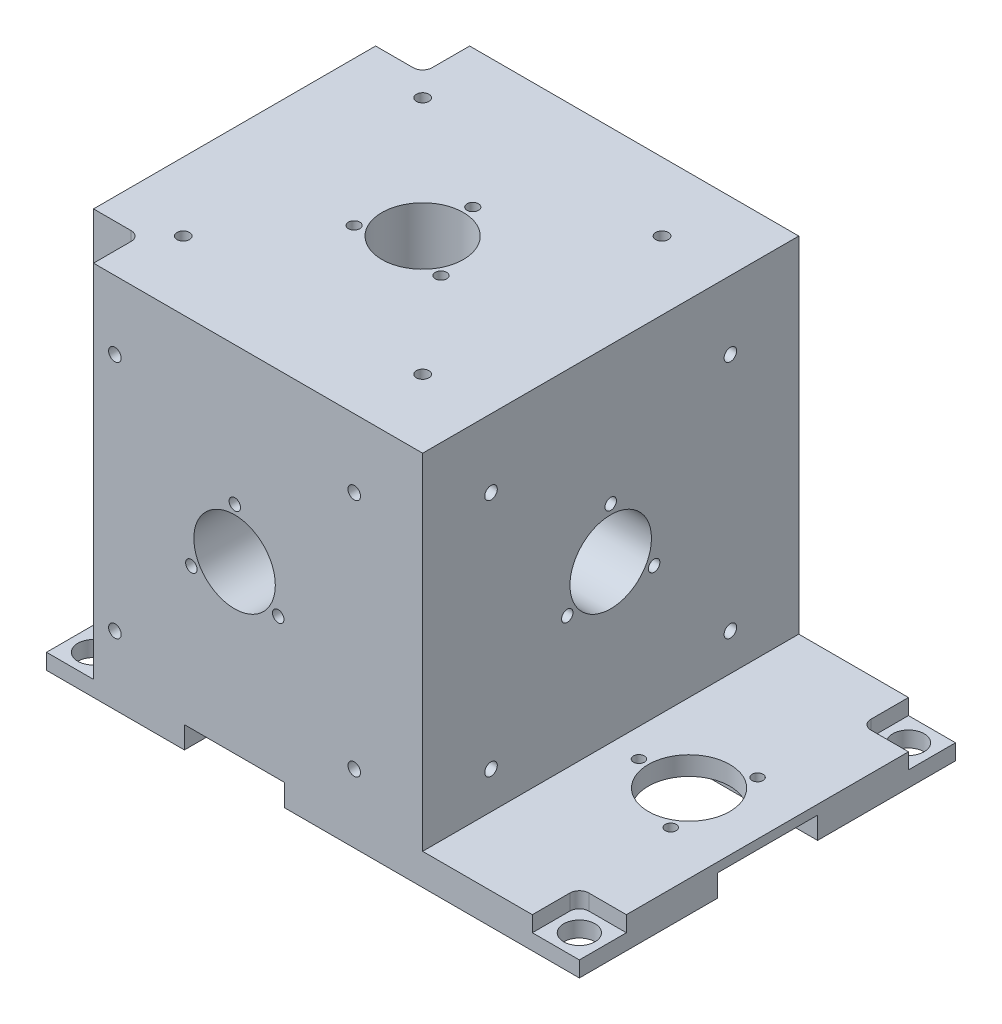
from build123d import *

# Parameters (mm, degrees)
BOSS_EXTRUDE1_DEPTH = 120
SKETCH3_W           = 120
SKETCH3_H           = 10
BOSS_EXTRUDE2_DEPTH = 50
SKETCH11_R          = 13
CUT_EXTRUDE3_DEPTH  = 120
SKETCH7_R           = 1.825
SKETCH7_R_2         = 2
CUT_EXTRUDE6_DEPTH  = 5
CUT_EXTRUDE12_DEPTH = 4
SKETCH10_R          = 13
CUT_EXTRUDE13_DEPTH = 116
SKETCH8_R           = 1.825
SKETCH8_R_2         = 2
CUT_EXTRUDE14_DEPTH = 5
SKETCH13_R          = 13
CUT_EXTRUDE17_DEPTH = 120
SKETCH17_R          = 13
CUT_EXTRUDE18_DEPTH = 6
SKETCH18_R          = 1.75
CUT_EXTRUDE19_DEPTH = 6
FILLET1_R           = 3
FILLET2_R           = 3
CHAMFER1_SIZE       = 3
SKETCH19_W          = 15
SKETCH19_H          = 15
CUT_EXTRUDE20_DEPTH = 115
SKETCH20_R          = 5
CUT_EXTRUDE21_DEPTH = 5
FILLET3_R           = 3
SKETCH21_W          = 15
SKETCH21_H          = 15
CUT_EXTRUDE22_DEPTH = 5
SKETCH22_R          = 5
CUT_EXTRUDE23_DEPTH = 5
FILLET4_R           = 3
CUT_EXTRUDE24_START = -5
SKETCH23_R          = 1.825
SKETCH23_R_2        = 2
CUT_EXTRUDE24_DEPTH = 5
CUT_EXTRUDE25_START = -5
SKETCH24_R          = 1.825
SKETCH24_R_2        = 2
CUT_EXTRUDE25_DEPTH = 5
SKETCH26_R          = 1.825
SKETCH26_R_2        = 2
CUT_EXTRUDE26_DEPTH = 5


with BuildPart() as part:
    # Sketch1 → Boss-Extrude1 (new body)
    with BuildSketch(Plane(origin=(0, 0, 0), x_dir=(1, 0, 0), z_dir=(0, 1, 0))):
        Polygon((-60, 60), (-60, -60), (60, -60), (60, 60), (0, 60), align=None)
    extrude(amount=BOSS_EXTRUDE1_DEPTH)

    # Sketch3 → Boss-Extrude2 (add)
    with BuildSketch(Plane(origin=(60, 0, 0), x_dir=(0, 0, -1), z_dir=(1, 0, 0))):
        with Locations((0, 5)):
            Rectangle(SKETCH3_W, SKETCH3_H)
    extrude(amount=BOSS_EXTRUDE2_DEPTH)

    # Sketch11 → Cut-Extrude3 (cut)
    with BuildSketch(Plane.XY.offset(60)):
        with Locations((0, 60)):
            Circle(SKETCH11_R)
    extrude(amount=-CUT_EXTRUDE3_DEPTH, mode=Mode.SUBTRACT)

    # Sketch7 → Cut-Extrude6 (cut)
    with BuildSketch(Plane.ZY.offset(60)):
        with Locations((0, 76)):
            Circle(SKETCH7_R)
        with Locations((13.856406461, 52)):
            Circle(SKETCH7_R)
        with Locations((-13.856406461, 52)):
            Circle(SKETCH7_R)
        with Locations((-38.183766184, 98.183766184)):
            Circle(SKETCH7_R_2)
        with Locations((38.183766184, 98.183766184)):
            Circle(SKETCH7_R_2)
        with Locations((38.183766184, 21.816233816)):
            Circle(SKETCH7_R_2)
        with Locations((-38.183766184, 21.816233816)):
            Circle(SKETCH7_R_2)
    extrude(amount=-CUT_EXTRUDE6_DEPTH, mode=Mode.SUBTRACT)

    # Sketch4 → Cut-Extrude12 (cut)
    with BuildSketch(Plane.XZ):
        Polygon((16, 16), (110, 16), (110, -16), (16, -16), (16, -60), (-16, -60), (-16, -16), (-60, -16), (-60, 16), (-16, 16), (-16, 60), (16, 60), align=None)
    extrude(amount=-CUT_EXTRUDE12_DEPTH, mode=Mode.SUBTRACT)

    # Sketch10 → Cut-Extrude13 (cut)
    with BuildSketch(Plane(origin=(0, 120, 0), x_dir=(1, 0, 0), z_dir=(0, 1, 0))):
        with Locations(Location((0, 0, 0), (0, 0, 270))):
            Circle(SKETCH10_R)
    extrude(amount=-CUT_EXTRUDE13_DEPTH, mode=Mode.SUBTRACT)

    # Sketch8 → Cut-Extrude14 (cut)
    with BuildSketch(Plane(origin=(0, 0, -60), x_dir=(-1, 0, 0), z_dir=(0, 0, -1))):
        with Locations((0, 76)):
            Circle(SKETCH8_R)
        with Locations((13.856406461, 52)):
            Circle(SKETCH8_R)
        with Locations((-13.856406461, 52)):
            Circle(SKETCH8_R)
        with Locations((-38.183766184, 98.183766184)):
            Circle(SKETCH8_R_2)
        with Locations((38.183766184, 98.183766184)):
            Circle(SKETCH8_R_2)
        with Locations((38.183766184, 21.816233816)):
            Circle(SKETCH8_R_2)
        with Locations((-38.183766184, 21.816233816)):
            Circle(SKETCH8_R_2)
    extrude(amount=-CUT_EXTRUDE14_DEPTH, mode=Mode.SUBTRACT)

    # Sketch13 → Cut-Extrude17 (cut)
    with BuildSketch(Plane(origin=(60, 0, 0), x_dir=(0, 0, -1), z_dir=(1, 0, 0))):
        with Locations((0, 60)):
            Circle(SKETCH13_R)
    extrude(amount=-CUT_EXTRUDE17_DEPTH, mode=Mode.SUBTRACT)

    # Sketch17 → Cut-Extrude18 (cut)
    with BuildSketch(Plane(origin=(0, 10, 0), x_dir=(1, 0, 0), z_dir=(0, 1, 0))):
        with Locations(Location((85, 0, 0), (0, 0, 270))):
            Circle(SKETCH17_R)
    extrude(amount=-CUT_EXTRUDE18_DEPTH, mode=Mode.SUBTRACT)

    # Sketch18 → Cut-Extrude19 (cut)
    with BuildSketch(Plane(origin=(0, 10, 0), x_dir=(1, 0, 0), z_dir=(0, 1, 0))):
        with Locations(Location((93, 13.856406461, 0), (0, 0, 270))):
            Circle(SKETCH18_R)
        with Locations(Location((69, 0, 0), (0, 0, 270))):
            Circle(SKETCH18_R)
        with Locations(Location((93, -13.856406461, 0), (0, 0, 270))):
            Circle(SKETCH18_R)
    extrude(amount=-CUT_EXTRUDE19_DEPTH, mode=Mode.SUBTRACT)

    # Fillet1
    fillet1_edges = [part.edges().sort_by_distance(p)[0] for p in [
        (16, 2, -16),
        (-16, 2, -16),
        (-16, 2, 16),
        (16, 2, 16),
    ]]
    fillet(fillet1_edges, radius=FILLET1_R)

    # Fillet2
    fillet2_edges = [part.edges().sort_by_distance(p)[0] for p in [
        (0, 4, -13),
    ]]
    fillet(fillet2_edges, radius=FILLET2_R)

    # Chamfer1
    chamfer1_edges = [part.edges().sort_by_distance(p)[0] for p in [
        (0, 4, 60),
        (110, 4, 0),
        (0, 4, -60),
        (-60, 4, 0),
    ]]
    chamfer(chamfer1_edges, length=CHAMFER1_SIZE)

    # Sketch19 → Cut-Extrude20 (cut)
    with BuildSketch(Plane(origin=(0, 120, 0), x_dir=(1, 0, 0), z_dir=(0, 1, 0))):
        with Locations((-52.5, 52.5)):
            Rectangle(SKETCH19_W, SKETCH19_H)
        with Locations((-52.5, -52.5)):
            Rectangle(SKETCH19_W, SKETCH19_H)
    extrude(amount=-CUT_EXTRUDE20_DEPTH, mode=Mode.SUBTRACT)

    # Sketch20 → Cut-Extrude21 (cut)
    with BuildSketch(Plane(origin=(0, 5, 0), x_dir=(1, 0, 0), z_dir=(0, 1, 0))):
        with Locations(Location((-52.5, 52.5, 0), (0, 0, 270))):
            Circle(SKETCH20_R)
        with Locations(Location((-52.5, -52.5, 0), (0, 0, 270))):
            Circle(SKETCH20_R)
    extrude(amount=-CUT_EXTRUDE21_DEPTH, mode=Mode.SUBTRACT)

    # Fillet3
    fillet3_edges = [part.edges().sort_by_distance(p)[0] for p in [
        (-45, 62.5, -45),
        (-45, 62.5, 45),
    ]]
    fillet(fillet3_edges, radius=FILLET3_R)

    # Sketch21 → Cut-Extrude22 (cut)
    with BuildSketch(Plane(origin=(0, 10, 0), x_dir=(1, 0, 0), z_dir=(0, 1, 0))):
        with Locations((102.5, -52.5)):
            Rectangle(SKETCH21_W, SKETCH21_H)
        with Locations((102.5, 52.5)):
            Rectangle(SKETCH21_W, SKETCH21_H)
    extrude(amount=-CUT_EXTRUDE22_DEPTH, mode=Mode.SUBTRACT)

    # Sketch22 → Cut-Extrude23 (cut)
    with BuildSketch(Plane(origin=(0, 5, 0), x_dir=(1, 0, 0), z_dir=(0, 1, 0))):
        with Locations(Location((102.5, 52.5, 0), (0, 0, 270))):
            Circle(SKETCH22_R)
        with Locations(Location((102.5, -52.5, 0), (0, 0, 270))):
            Circle(SKETCH22_R)
    extrude(amount=-CUT_EXTRUDE23_DEPTH, mode=Mode.SUBTRACT)

    # Fillet4
    fillet4_edges = [part.edges().sort_by_distance(p)[0] for p in [
        (95, 7.5, 45),
        (95, 7.5, -45),
    ]]
    fillet(fillet4_edges, radius=FILLET4_R)

    # Sketch23 → Cut-Extrude24 (cut)
    with BuildSketch(Plane.XY.offset(60).offset(CUT_EXTRUDE24_START)):
        with Locations((0.077859326, 75.922140674)):
            Circle(SKETCH23_R)
        with Locations((13.934265787, 51.922140674)):
            Circle(SKETCH23_R)
        with Locations((-13.778547134, 51.922140674)):
            Circle(SKETCH23_R)
        with Locations(Location((-38.183766184, 98.183766184, 0), (0, 0, 180))):
            Circle(SKETCH23_R_2)
        with Locations(Location((38.183766184, 98.183766184, 0), (0, 0, 180))):
            Circle(SKETCH23_R_2)
        with Locations(Location((38.183766184, 21.816233816, 0), (0, 0, 180))):
            Circle(SKETCH23_R_2)
        with Locations(Location((-38.183766184, 21.816233816, 0), (0, 0, 180))):
            Circle(SKETCH23_R_2)
    extrude(amount=CUT_EXTRUDE24_DEPTH, mode=Mode.SUBTRACT)

    # Sketch24 → Cut-Extrude25 (cut)
    with BuildSketch(Plane(origin=(60, 0, 0), x_dir=(0, 0, -1), z_dir=(1, 0, 0)).offset(CUT_EXTRUDE25_START)):
        with Locations(Location((0, 76, 0), (0, 0, 180))):
            Circle(SKETCH24_R)
        with Locations(Location((13.856406461, 52, 0), (0, 0, 180))):
            Circle(SKETCH24_R)
        with Locations(Location((-13.856406461, 52, 0), (0, 0, 180))):
            Circle(SKETCH24_R)
        with Locations(Location((-38.183766184, 98.183766184, 0), (0, 0, 180))):
            Circle(SKETCH24_R_2)
        with Locations(Location((38.183766184, 98.183766184, 0), (0, 0, 180))):
            Circle(SKETCH24_R_2)
        with Locations(Location((38.183766184, 21.816233816, 0), (0, 0, 180))):
            Circle(SKETCH24_R_2)
        with Locations(Location((-38.183766184, 21.816233816, 0), (0, 0, 180))):
            Circle(SKETCH24_R_2)
    extrude(amount=CUT_EXTRUDE25_DEPTH, mode=Mode.SUBTRACT)

    # Sketch26 → Cut-Extrude26 (cut)
    with BuildSketch(Plane(origin=(0, 120, 0), x_dir=(1, 0, 0), z_dir=(0, 1, 0))):
        with Locations(Location((0, 16, 0), (0, 0, 270))):
            Circle(SKETCH26_R)
        with Locations(Location((13.856406461, -8, 0), (0, 0, 270))):
            Circle(SKETCH26_R)
        with Locations(Location((-13.856406461, -8, 0), (0, 0, 270))):
            Circle(SKETCH26_R)
        with Locations(Location((-38.183766184, 38.183766184, 0), (0, 0, 270))):
            Circle(SKETCH26_R_2)
        with Locations(Location((38.183766184, 38.183766184, 0), (0, 0, 270))):
            Circle(SKETCH26_R_2)
        with Locations(Location((38.183766184, -38.183766184, 0), (0, 0, 270))):
            Circle(SKETCH26_R_2)
        with Locations(Location((-38.183766184, -38.183766184, 0), (0, 0, 270))):
            Circle(SKETCH26_R_2)
    extrude(amount=-CUT_EXTRUDE26_DEPTH, mode=Mode.SUBTRACT)


solid = part.part
